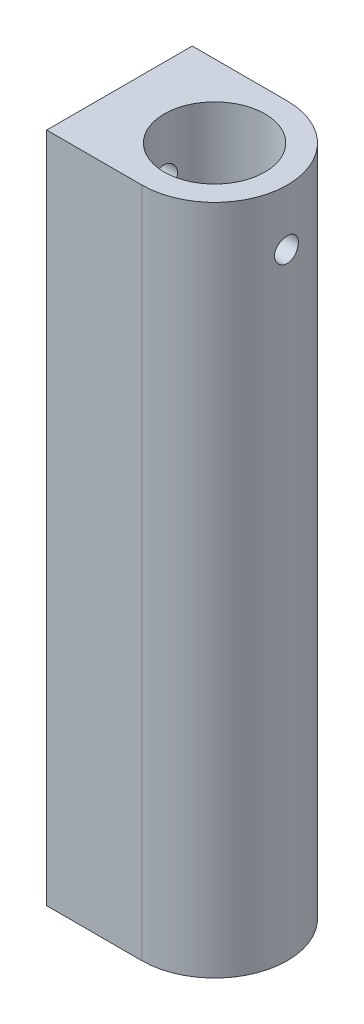
from build123d import *

# Parameters (mm, degrees)
SKETCH1_R             = 5.715
BOSS_EXTRUDE1_DEPTH   = 76.2
SKETCH4_R             = 5.715
SKETCH4_R_2           = 5.207
BOSS_EXTRUDE2_DEPTH   = 3.81
F_6_32_TAPPED_HOLE1_D = 2.7051


with BuildPart() as part:
    # Sketch1 → Boss-Extrude1 (new body)
    with BuildSketch(Plane(origin=(0, 0, 0), x_dir=(1, 0, 0), z_dir=(0, 1, 0))):
        with BuildLine():
            Line((0, 8.255), (-10.795, 8.255))
            Line((-10.795, 8.255), (-10.795, -8.255))
            Line((-10.795, -8.255), (0, -8.255))
            ThreePointArc((0, -8.255), (8.255, 0), (0, 8.255))
        make_face()
        with Locations(Location((0, 0, 0), (0, 0, 90))):
            Circle(SKETCH1_R, mode=Mode.SUBTRACT)
    extrude(amount=BOSS_EXTRUDE1_DEPTH)

    # Sketch4 → Boss-Extrude2 (add)
    with BuildSketch(Plane.XZ):
        with Locations(Location((0, 0, 0), (0, 0, 270))):
            Circle(SKETCH4_R)
        with Locations(Location((0, 0, 0), (0, 0, 270))):
            Circle(SKETCH4_R_2, mode=Mode.SUBTRACT)
    extrude(amount=-BOSS_EXTRUDE2_DEPTH)

    # #6-32 Tapped Hole1 (through all)
    with Locations(Plane.ZY.offset(10.795)):
        with Locations((0, 69.85)):
            Hole(F_6_32_TAPPED_HOLE1_D / 2)


solid = part.part
